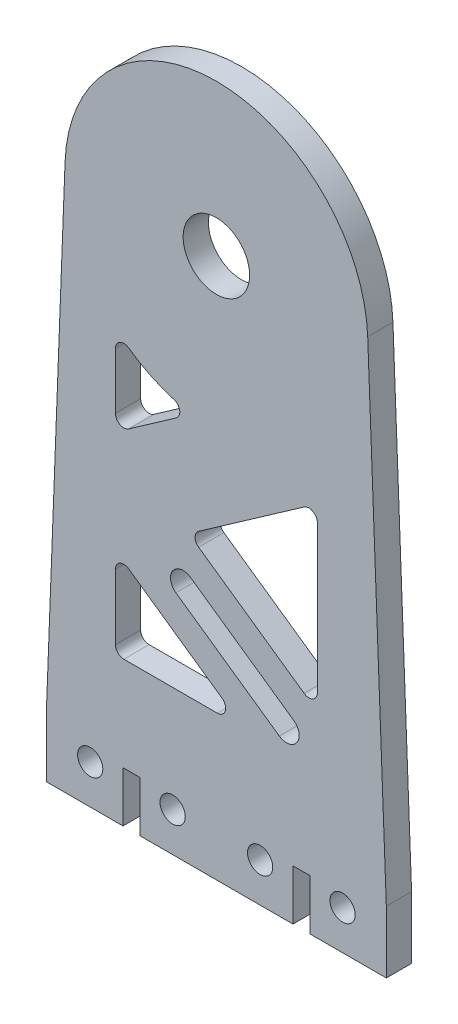
from build123d import *

# Parameters (mm, degrees)
SKETCH1_R               = 1.5
SKETCH1_R_2             = 3.95
MAIN_BODY_LINK_B1_DEPTH = 3
CUT_EXTRUDE1_REACH      = 168.945
PULLEYIDLER_DEPTH       = 3
FILLET1_R               = 1


with BuildPart() as part:
    # Sketch1 → Main Body Link B1 (new body)
    with BuildSketch(Plane.XY):
        with BuildLine():
            Line((0, 83.474052381), (9.1, 83.474052381))
            Line((9.1, 83.474052381), (9.1, 89.474052381))
            Line((9.1, 89.474052381), (11.1, 89.474052381))
            Line((11.1, 89.474052381), (11.1, 83.474052381))
            Line((11.1, 83.474052381), (20.2, 83.474052381))
            Line((20.2, 83.474052381), (20.2, 90.874052381))
            Line((20.2, 90.874052381), (17.986683974, 148.383116621))
            ThreePointArc((17.986683974, 148.383116621), (0, 165.690874165), (-17.986683974, 148.383116621))
            Line((-17.986683974, 148.383116621), (-20.2, 90.874052381))
            Line((-20.2, 90.874052381), (-20.2, 83.474052381))
            Line((-20.2, 83.474052381), (-11.1, 83.474052381))
            Line((-11.1, 83.474052381), (-11.1, 89.474052381))
            Line((-11.1, 89.474052381), (-9.1, 89.474052381))
            Line((-9.1, 89.474052381), (-9.1, 83.474052381))
            Line((-9.1, 83.474052381), (0, 83.474052381))
        make_face()
        with Locations((5.2, 88.124052381)):
            Circle(SKETCH1_R, mode=Mode.SUBTRACT)
        with Locations((15, 88.124052381)):
            Circle(SKETCH1_R, mode=Mode.SUBTRACT)
        with Locations((-15, 88.124052381)):
            Circle(SKETCH1_R, mode=Mode.SUBTRACT)
        with Locations((-5.2, 88.124052381)):
            Circle(SKETCH1_R, mode=Mode.SUBTRACT)
        with Locations((0, 147.690874165)):
            Circle(SKETCH1_R_2, mode=Mode.SUBTRACT)
    extrude(amount=MAIN_BODY_LINK_B1_DEPTH)

    # Sketch2 → Cut-Extrude1 (cut, up to next)
    with BuildSketch(Plane.XY.offset(3), mode=Mode.PRIVATE) as cut_extrude1_sk1:
        Polygon((-3.278172542, 117.482670232), (12, 128.172168466), (12, 106.793171999), align=None)
    cut_extrude1_tool1 = extrude(cut_extrude1_sk1.sketch, amount=-CUT_EXTRUDE1_REACH, mode=Mode.PRIVATE) & part.part
    # Sketch2 → Cut-Extrude1 (cut, up to next)
    with BuildSketch(Plane.XY.offset(3), mode=Mode.PRIVATE) as cut_extrude1_sk2:
        with BuildLine():
            ThreePointArc((-12, 134.2744663), (-7.774454217, 131.456408925), (-2.929911079, 129.930929878))
            Line((-2.929911079, 129.930929878), (-12, 123.584968066))
            Line((-12, 123.584968066), (-12, 134.2744663))
        make_face()
    cut_extrude1_tool2 = extrude(cut_extrude1_sk2.sketch, amount=-CUT_EXTRUDE1_REACH, mode=Mode.PRIVATE) & part.part
    # Sketch2 → Cut-Extrude1 (cut, up to next)
    with BuildSketch(Plane.XY.offset(3), mode=Mode.PRIVATE) as cut_extrude1_sk3:
        Polygon((-12, 111.380372399), (-12, 100.690874165), (3.278172542, 100.690874165), align=None)
    cut_extrude1_tool3 = extrude(cut_extrude1_sk3.sketch, amount=-CUT_EXTRUDE1_REACH, mode=Mode.PRIVATE) & part.part
    add(cut_extrude1_tool1.solids().sort_by_distance((6.907276, 117.48267, 3))[0], mode=Mode.SUBTRACT)
    add(cut_extrude1_tool2.solids().sort_by_distance((-9.12997, 128.978342, 3))[0], mode=Mode.SUBTRACT)
    add(cut_extrude1_tool3.solids().sort_by_distance((-6.907276, 104.25404, 3))[0], mode=Mode.SUBTRACT)

    # Sketch3 → PulleyIdler (cut)
    with BuildSketch(Plane.XY.offset(3)):
        with BuildLine():
            Line((-4.812543936, 110.623218529), (7.477908291, 102.024103222))
            ThreePointArc((7.477908291, 102.024103222), (9.566865044, 102.393236914), (9.197731352, 104.482193668))
            Line((9.197731352, 104.482193668), (-3.092720875, 113.081308975))
            ThreePointArc((-3.092720875, 113.081308975), (-5.181677628, 112.712175283), (-4.812543936, 110.623218529))
        make_face()
    extrude(amount=-PULLEYIDLER_DEPTH, mode=Mode.SUBTRACT)

    # Fillet1
    fillet1_edges = [part.edges().sort_by_distance(p)[0] for p in [
        (-3.278172542, 117.482670232, 1.5),
        (12, 128.172168466, 1.5),
        (12, 106.793171999, 1.5),
        (-12, 134.2744663, 1.5),
        (-2.929911079, 129.930929878, 1.5),
        (-12, 123.584968066, 1.5),
        (-12, 111.380372399, 1.5),
        (3.278172542, 100.690874165, 1.5),
        (-12, 100.690874165, 1.5),
    ]]
    fillet(fillet1_edges, radius=FILLET1_R)


solid = part.part
